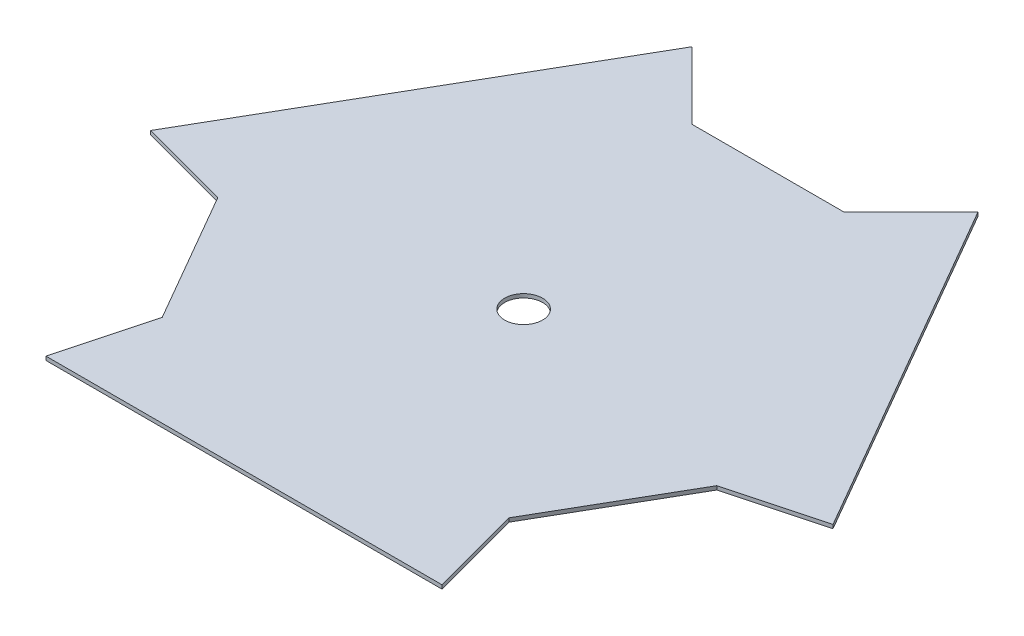
from build123d import *

# Parameters (mm, degrees)
BOSS_EXTRUDE1_DEPTH = 2
SKETCH2_R           = 10
CUT_EXTRUDE1_DEPTH  = 434.878349498
SKETCH4_OUTSIDE_W   = 492.732
SKETCH4_OUTSIDE_H   = 440.742
CUT_EXTRUDE2_DEPTH  = 3


with BuildPart() as part:
    # Sketch1 → Boss-Extrude1 (new body)
    with BuildSketch(Plane(origin=(0, 0, 0), x_dir=(1, 0, 0), z_dir=(0, 1, 0))):
        Polygon((-132.853430349, -388.070415552), (132.853430349, -388.070415552), (194.030344885, -282.108891325), (61.176914536, -52), (-61.176914536, -52), (-194.030344885, -282.108891325), align=None)
    extrude(amount=BOSS_EXTRUDE1_DEPTH)

    # Sketch2 → Cut-Extrude1 (cut, through all)
    with BuildSketch(Plane(origin=(0, 2, 0), x_dir=(1, 0, 0), z_dir=(0, 1, 0))):
        with Locations(Location((0, -240.726435625, 0), (0, 0, 270))):
            Circle(SKETCH2_R)
    extrude(amount=-CUT_EXTRUDE1_DEPTH, mode=Mode.SUBTRACT)

    # Sketch4 outside → Cut-Extrude2 (cut)
    with BuildSketch(Plane(origin=(0, 2, 0), x_dir=(1, 0, 0), z_dir=(0, 1, 0))):
        with Locations((0, -220.035)):
            Rectangle(SKETCH4_OUTSIDE_W, SKETCH4_OUTSIDE_H)
        Polygon((-75.405516164, -76.644660941), (-40.050177105, -112), (40.050177105, -112), (75.405516164, -76.644660941), (179.801743257, -257.464230384), (131.505451943, -270.405182639), (91.455274838, -339.774124237), (104.396227093, -388.070415552), (-104.396227093, -388.070415552), (-91.455274838, -339.774124237), (-131.505451943, -270.405182639), (-179.801743257, -257.464230384), align=None, mode=Mode.SUBTRACT)
    extrude(amount=-CUT_EXTRUDE2_DEPTH, mode=Mode.SUBTRACT)


solid = part.part
